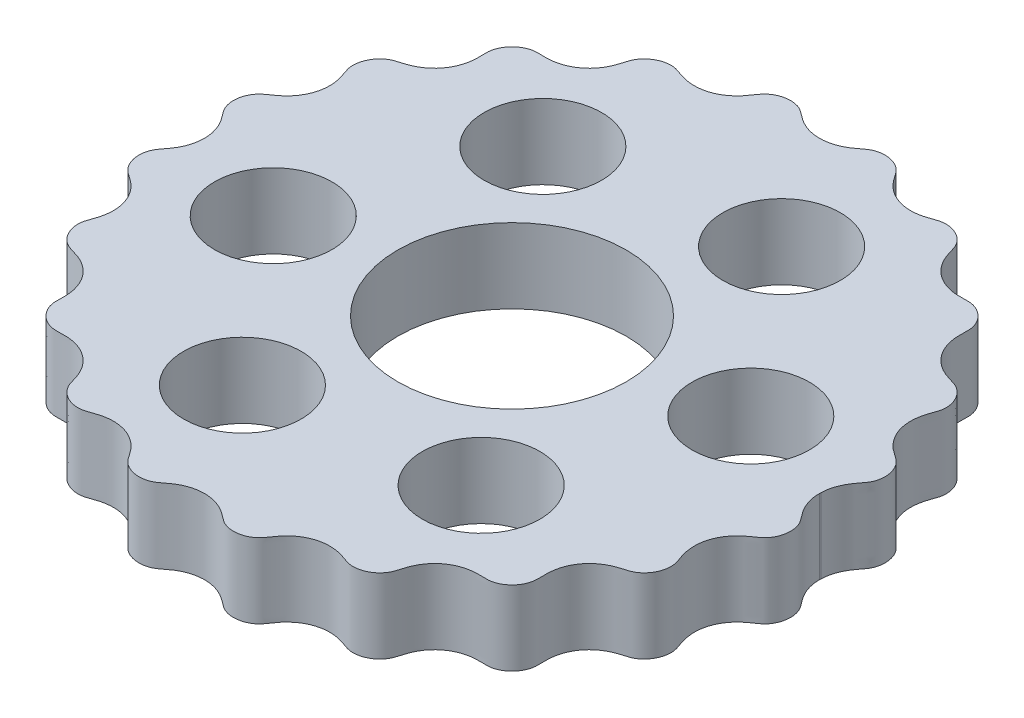
from build123d import *

# Parameters (mm, degrees)
SKETCH1_R           = 10.4
BOSS_EXTRUDE1_DEPTH = 6.8
SKETCH3_R           = 5.35
CUT_EXTRUDE1_DEPTH  = 43.495833342


with BuildPart() as part:
    # Sketch1 → Boss-Extrude1 (new body)
    with BuildSketch(Plane(origin=(0, 0, 0), x_dir=(1, 0, 0), z_dir=(0, 1, 0))):
        with BuildLine():
            add(Edge.make_bspline(
                [(28, 0), (28, -0.031031349), (28.000664585, -0.077562013), (28.002880061, -0.148625962), (28.008857323, -0.265030804), (28.01748439, -0.378165866), (28.035377174, -0.532449994), (28.06975465, -0.744031815), (28.124898528, -0.988402272), (28.208291328, -1.260754977), (28.310763489, -1.527479674), (28.432264517, -1.78553412), (28.586475915, -2.065550339), (28.781240437, -2.361249596), (29.013710566, -2.671510887), (29.282434665, -2.997909262), (29.511090265, -3.399330908), (29.650641795, -3.879617947), (29.685943401, -4.415209937), (29.595050036, -4.98366351), (29.393332982, -5.482667687), (29.108390624, -5.897533807), (28.762039685, -6.207243903), (28.403477037, -6.435442884), (28.026266021, -6.701844442), (27.64319557, -7.023691154), (27.180082711, -7.524317118), (26.718464045, -8.267029277), (26.411916475, -9.252490746), (26.412585588, -10.23832478), (26.591144298, -11.003215534), (26.788245534, -11.554847613), (26.926996187, -11.920540426), (27.04353273, -12.498351115), (26.949273296, -13.292291113), (26.579231695, -14.011203462), (25.979864827, -14.553993599), (25.426081192, -14.793657027), (25.031899301, -14.895827838), (24.598577298, -15.029618089), (24.134125138, -15.214708043), (23.655411415, -15.480342094), (23.184349595, -15.840952149), (22.673753465, -16.373943796), (22.203830759, -17.12510049), (21.950799886, -17.926805445), (21.888983864, -18.704964764), (21.907789185, -19.286886173), (21.924859771, -19.675174385), (21.871149911, -20.111154063), (21.705597474, -20.571085866), (21.337846804, -21.153739973), (20.84201349, -21.573706881), (20.342413095, -21.80966339), (19.85014486, -21.905332113), (19.542764705, -21.922070062), (19.184788107, -21.90195931), (18.729055825, -21.895280733), (18.227020872, -21.931313679), (17.541142399, -22.068791717), (16.71738225, -22.413536733), (15.891229619, -23.048350202), (15.32362548, -23.857086792), (15.029931219, -24.575501935), (14.870744642, -25.131672024), (14.765974038, -25.503517496), (14.578093522, -25.897334327), (14.278137655, -26.27956758), (13.863211568, -26.621949382), (13.333466392, -26.885228535), (12.798871593, -27.009248508), (12.290552673, -27.011301219), (11.843557682, -26.90219562), (11.460571198, -26.75121757), (11.025689397, -26.60543435), (10.534018496, -26.485849414), (9.834176397, -26.408732243), (8.943191753, -26.48928166), (8.101715728, -26.795494492), (7.375116763, -27.296483528), (6.902348496, -27.776858053), (6.606598531, -28.155474042), (6.366083646, -28.513256616), (6.151840123, -28.831695176), (5.850343501, -29.143571455), (5.44849282, -29.410335403), (4.952930608, -29.603689196), (4.378140564, -29.688000673), (3.887171763, -29.648261477), (3.499857409, -29.537846694), (3.21757098, -29.405101209), (3.027395345, -29.289163366), (2.803594257, -29.123996953), (2.543296711, -28.915671476), (2.200975392, -28.666191524), (1.757738569, -28.405972128), (1.252718637, -28.191044593), (0.688410871, -28.043749551), (-0.032568257, -27.968354591), (-0.75572454, -28.038417959), (-1.447945714, -28.250687916), (-2.040364953, -28.563265751), (-2.43508463, -28.83214679), (-2.771481416, -29.097279113), (-3.073006342, -29.330941262), (-3.455359553, -29.529806436), (-3.917651053, -29.656056137), (-4.447139358, -29.684551772), (-5.019569429, -29.585408027), (-5.526314972, -29.371633211), (-5.901089956, -29.099575061), (-6.149417714, -28.82430515), (-6.342916663, -28.55017367), (-6.52768605, -28.270341803), (-6.778653094, -27.926106571), (-7.123898857, -27.541297135), (-7.542497613, -27.181412054), (-8.038978416, -26.868913717), (-8.708238445, -26.578220526), (-9.424190957, -26.427468439), (-10.153540712, -26.423523025), (-10.812857393, -26.54571293), (-11.265134105, -26.682147995), (-11.657194526, -26.828411897), (-12.003570583, -26.949288237), (-12.419349208, -27.0163226), (-12.893155845, -26.993505697), (-13.405546162, -26.856727423), (-13.922436399, -26.582438076), (-14.297340969, -26.255785564), (-14.545228892, -25.932420691), (-14.693513799, -25.653848142), (-14.777193881, -25.44474727), (-14.859768339, -25.175886882), (-14.94961111, -24.850892912), (-15.084325599, -24.444125067), (-15.297380805, -23.969854579), (-15.589092151, -23.497394056), (-15.970296988, -23.047055376), (-16.413014657, -22.662440809), (-16.905975708, -22.351506466), (-17.436562915, -22.119690928), (-17.991822389, -21.968687816), (-18.510209424, -21.903570911), (-18.979622982, -21.895472642), (-19.395216231, -21.914147378), (-19.760122128, -21.919892844), (-20.173368062, -21.852207015), (-20.613313595, -21.682775401), (-21.055976613, -21.393420873), (-21.461345683, -20.97164431), (-21.715951351, -20.543138764), (-21.850483054, -20.156060997), (-21.903595175, -19.843149855), (-21.917067504, -19.61707751), (-21.911419002, -19.334325238), (-21.896813922, -18.995552281), (-21.900821651, -18.564628351), (-21.95998452, -18.045081696), (-22.095709809, -17.503380239), (-22.324562172, -16.955868497), (-22.631906223, -16.454539193), (-23.008454099, -16.009979236), (-23.443097224, -15.630575573), (-23.923502175, -15.320894907), (-24.394614793, -15.102998218), (-24.836373872, -14.95288347), (-25.235273193, -14.843563999), (-25.58163527, -14.734658302), (-25.950103295, -14.540740978), (-26.31233868, -14.243529727), (-26.641372876, -13.831416863), (-26.894800573, -13.304359235), (-27.002946452, -12.816593176), (-27.009112874, -12.404516787), (-26.960506386, -12.089055157), (-26.901637758, -11.86907346), (-26.807460002, -11.600758064), (-26.688704284, -11.281110833), (-26.560148648, -10.867230496), (-26.458033102, -10.351364226), (-26.423156439, -9.790825053), (-26.476420934, -9.196404965), (-26.619091955, -8.624310238), (-26.844481609, -8.087344303), (-27.143662697, -7.596479599), (-27.505502372, -7.159053145), (-27.885770863, -6.810752242), (-28.258231334, -6.534623838), (-28.602197984, -6.309201905), (-28.895071379, -6.097739956), (-29.181628557, -5.798860374), (-29.430622755, -5.405352873), (-29.613193841, -4.914013425), (-29.689431096, -4.338059144), (-29.641317845, -3.842066694), (-29.519046209, -3.447630328), (-29.347230354, -3.107551616), (-29.176911045, -2.87010865), (-28.994326163, -2.643518506), (-28.784933249, -2.363547245), (-28.571500211, -2.047545383), (-28.345161016, -1.633004027), (-28.14358345, -1.107376567), (-28.017029617, -0.525985365), (-27.981859645, 0.060151868), (-28.035406584, 0.637175938), (-28.172082425, 1.192026354), (-28.383290312, 1.714776498), (-28.63818744, 2.159125147), (-28.906808596, 2.533486567), (-29.163211752, 2.852024262), (-29.373361181, 3.143662764), (-29.54964244, 3.51572955), (-29.661770312, 3.964827844), (-29.681448424, 4.487079756), (-29.574218643, 5.057988123), (-29.372915323, 5.515007066), (-29.131683637, 5.853186557), (-28.901310345, 6.081455236), (-28.71733887, 6.22699728), (-28.523830586, 6.359217381), (-28.329480908, 6.489865049), (-28.090288895, 6.658903412), (-27.789146582, 6.896331732), (-27.445538533, 7.224109569), (-27.092401473, 7.666596028), (-26.794617181, 8.185486692), (-26.584211015, 8.735334535), (-26.461833383, 9.301427774), (-26.425227124, 9.869575923), (-26.468172124, 10.427796633), (-26.57539464, 10.925269878), (-26.715902845, 11.361033992), (-26.860864887, 11.740964632), (-26.967643183, 12.082349347), (-27.016923469, 12.488849335), (-26.982539247, 12.947562526), (-26.852213504, 13.40022156), (-26.632187174, 13.825541839), (-26.365823813, 14.173243793), (-26.076266903, 14.444258568), (-25.746657166, 14.660554827), (-25.384347071, 14.803955947), (-25.013174175, 14.901888221), (-24.649825417, 15.014330048), (-24.205456498, 15.183943807), (-23.697981694, 15.448136434), (-23.19279069, 15.821811464), (-22.727598822, 16.321001516), (-22.376687134, 16.856656853), (-22.130069092, 17.402971906), (-21.978147244, 17.949424395), (-21.913956294, 18.420845127), (-21.898301955, 18.804719145), (-21.901885571, 19.098138001), (-21.910364295, 19.332599431), (-21.917356186, 19.567290625), (-21.908247038, 19.802120465), (-21.859642973, 20.123388586), (-21.728314478, 20.518321223), (-21.477258115, 20.950469614), (-21.078915406, 21.373185728), (-20.645642238, 21.664528758), (-20.217606093, 21.838212475), (-19.81395087, 21.915200378), (-19.455090494, 21.91746772), (-19.047465403, 21.897158238), (-18.587695109, 21.899303041), (-18.079419392, 21.953162665), (-17.533342209, 22.087938967), (-17.004169367, 22.301728649), (-16.505109003, 22.596039084), (-16.050057404, 22.968007225), (-15.652263558, 23.411950504), (-15.343738112, 23.88416209), (-15.140451853, 24.311413051), (-15.00916899, 24.67024555), (-14.923108555, 24.949105909), (-14.859272465, 25.17353993), (-14.793147582, 25.397519172), (-14.710914793, 25.616330064), (-14.564233641, 25.904241858), (-14.316887562, 26.236050862), (-13.944188937, 26.567290224), (-13.433671312, 26.844662271), (-12.929592484, 26.986306774), (-12.465862868, 27.016938878), (-12.056290812, 26.961980817), (-11.713377661, 26.850314018), (-11.329649416, 26.704649039), (-10.888443566, 26.565360279), (-10.384483683, 26.461685167), (-9.819320952, 26.42479376), (-9.246932195, 26.46959031), (-8.679725254, 26.601148914), (-8.13189378, 26.820596294), (-7.61790981, 27.12615642), (-7.183298081, 27.483573339), (-6.824584378, 27.869492476), (-6.564372631, 28.217104645), (-6.3750587, 28.501500012), (-6.213296167, 28.736014133), (-6.07006888, 28.913600751), (-5.843517403, 29.139305653), (-5.5063042, 29.377601905), (-5.048020671, 29.577557287), (-4.472836828, 29.682943813), (-3.946505973, 29.659706968), (-3.493869262, 29.542417914), (-3.120634811, 29.359656954), (-2.828972318, 29.144471163), (-2.506836899, 28.886341612), (-2.126888917, 28.617266556), (-1.675206917, 28.363868325), (-1.144021603, 28.156435171), (-0.582661964, 28.02636271), (-0.001890933, 27.981296185), (0.58501359, 28.025647964), (1.163951978, 28.161086845), (1.683441687, 28.36893866), (2.139888531, 28.626125065), (2.491860332, 28.876215675), (2.757963051, 29.087427108), (2.983609202, 29.258786788), (3.174495471, 29.381446804), (3.459083205, 29.523339502), (3.851854319, 29.642968902), (4.348516024, 29.689533813), (4.928039846, 29.610137785), (5.422099408, 29.422934164), (5.817403714, 29.167853492), (6.115283499, 28.874692567), (6.325372059, 28.577061424), (6.553872205, 28.230405596), (6.835248426, 27.855825213), (7.191069249, 27.474840691), (7.637712718, 27.114121837), (8.135675959, 26.820050662), (8.676257821, 26.602398199), (9.247777769, 26.468503499), (9.8372148, 26.423188442), (10.392080485, 26.463744103), (10.902188743, 26.569430587), (11.311408894, 26.699284163), (11.627802053, 26.817712849), (11.894228581, 26.909467976), (12.112860236, 26.965303648), (12.42589622, 27.009896555), (12.834025678, 27.000146678), (13.319196858, 26.889378791), (13.845153306, 26.633026021), (14.257038724, 26.299760104), (14.554041609, 25.931167483), (14.744858665, 25.556647), (14.851157653, 25.206205972), (14.962768699, 24.803779515), (15.117305141, 24.3584135), (15.404121971, 23.753955429), (15.833875149, 23.165934197), (16.374909205, 22.67403309), (17.002579382, 22.301478605), (17.547717463, 22.081681443), (18.085705531, 21.953059447), (18.600843863, 21.899006114), (19.027718225, 21.897607026), (19.363306625, 21.912804166), (19.643510312, 21.916577445), (19.867343088, 21.900617162), (20.176671824, 21.844476785), (20.558874159, 21.70781217), (20.982160211, 21.452675575), (21.399217128, 21.048510346), (21.687723584, 20.604087838), (21.85771662, 20.157247476), (21.922648534, 19.732096865), (21.91156507, 19.351655854), (21.894463869, 18.92460385), (21.908205264, 18.448223307), (22.001912439, 17.786375903), (22.234946014, 17.101808505), (22.6013126, 16.474750796), (23.084711369, 15.934134159), (23.5354966, 15.562265361), (24.006530278, 15.278421196), (24.478137245, 15.071534791), (24.881821655, 14.940491454), (25.203951204, 14.852086447), (25.469756895, 14.768372409), (25.675938251, 14.683009626), (25.950151182, 14.533002939), (26.268223191, 14.284645826), (26.589714687, 13.910902088), (26.859890893, 13.396673658), (26.995311132, 12.88281003), (27.016525018, 12.402035718), (26.942836993, 11.975508372), (26.812034137, 11.615548358), (26.66389045, 11.211678455), (26.530995558, 10.751024764), (26.419030556, 10.087782053), (26.438423676, 9.205988209), (26.682840762, 8.344460734), (27.139678155, 7.574465368), (27.613264054, 7.051514451), (27.999218433, 6.72275474), (28.373217369, 6.455649292), (28.721151792, 6.234275947), (29.073689192, 5.937225968), (29.372166962, 5.524502035), (29.586978196, 5.018911749), (29.685919297, 4.435745593), (29.653681482, 3.899251815), (29.521743881, 3.432816911), (29.315424046, 3.049403046), (29.076634529, 2.746649138), (28.854976464, 2.462422135), (28.662547192, 2.185228529), (28.501739115, 1.916498604), (28.369735291, 1.659003295), (28.256193722, 1.392681001), (28.162088593, 1.119260422), (28.097627202, 0.874181121), (28.055500454, 0.660141377), (28.032146858, 0.504627846), (28.019647513, 0.390953761), (28.009738061, 0.273140835), (28.00514711, 0.200761759), (28.002956293, 0.153593073), (28.001951271, 0.122143989)],
                knots=[0.064575154, 0.064575154, 0.064575154, 0.064575154, 0.064575154, 0.065183591, 0.06548781, 0.065792028, 0.066400465, 0.067008902, 0.068225777, 0.069442651, 0.070659525, 0.0718764, 0.073093274, 0.074310148, 0.076111476, 0.077912804, 0.079714132, 0.08151546, 0.083941756, 0.086368053, 0.088809002, 0.091249952, 0.093061606, 0.09487326, 0.096684914, 0.098496568, 0.100945225, 0.103393881, 0.108291195, 0.113292604, 0.118294014, 0.119961376, 0.121628737, 0.123296099, 0.124963461, 0.129954037, 0.134964041, 0.136701765, 0.138439489, 0.140177212, 0.141914936, 0.144438131, 0.146961326, 0.149484521, 0.152007716, 0.156981085, 0.161954454, 0.163610909, 0.165267364, 0.166923819, 0.168580274, 0.171060329, 0.173540383, 0.178580711, 0.179454318, 0.180327926, 0.18207514, 0.183822355, 0.185569569, 0.18810821, 0.190646851, 0.195724132, 0.200669307, 0.205614481, 0.207260162, 0.208905843, 0.210551525, 0.212197206, 0.214661967, 0.217126729, 0.219661961, 0.222197193, 0.223953977, 0.225710761, 0.227467545, 0.229224329, 0.231778343, 0.234332357, 0.239440385, 0.244357202, 0.246815611, 0.24927402, 0.250909074, 0.252544127, 0.254179181, 0.255814235, 0.258263652, 0.26071307, 0.263180523, 0.265647975, 0.266596818, 0.26754566, 0.268494503, 0.269443345, 0.27134103, 0.273238715, 0.2757181, 0.278197486, 0.280676871, 0.283156257, 0.288044546, 0.29048869, 0.292932834, 0.294557358, 0.296181881, 0.297806404, 0.299430928, 0.301865085, 0.304299242, 0.306781128, 0.309263013, 0.311171465, 0.312125691, 0.313079917, 0.314988369, 0.316896821, 0.319390582, 0.321884343, 0.324378105, 0.326871866, 0.331797418, 0.334260193, 0.336722969, 0.338285219, 0.33984747, 0.34140972, 0.34297197, 0.345428594, 0.347885218, 0.350381431, 0.352877644, 0.353837262, 0.35479688, 0.355756498, 0.356716116, 0.358635353, 0.360554589, 0.363062682, 0.365570774, 0.368078866, 0.370586959, 0.373033529, 0.3754801, 0.377926671, 0.380373241, 0.381927053, 0.383480864, 0.385034676, 0.386588487, 0.389029846, 0.391471206, 0.393981633, 0.39649206, 0.397457075, 0.39842209, 0.399387105, 0.40035212, 0.402282151, 0.404212181, 0.406734559, 0.409256937, 0.411779314, 0.414301692, 0.41673198, 0.419162268, 0.421592556, 0.424022844, 0.425568398, 0.427113953, 0.428659507, 0.430205061, 0.432631132, 0.435057203, 0.437581726, 0.440106249, 0.441076661, 0.442047073, 0.443017486, 0.443987898, 0.445928723, 0.447869547, 0.450406163, 0.452942779, 0.455479396, 0.458016012, 0.460429941, 0.462843871, 0.465257801, 0.467671731, 0.469209216, 0.4707467, 0.472284185, 0.47382167, 0.476232438, 0.478643206, 0.481151977, 0.483660747, 0.484655025, 0.485649303, 0.487637859, 0.488632137, 0.489626415, 0.491614971, 0.494143736, 0.496672502, 0.499201267, 0.501730032, 0.50412753, 0.506525028, 0.508922526, 0.511320024, 0.512849634, 0.514379244, 0.515908855, 0.517438465, 0.519833922, 0.52222938, 0.524752243, 0.527275106, 0.528274831, 0.529274556, 0.530274281, 0.531274006, 0.532273731, 0.533273456, 0.535272906, 0.537815564, 0.540358222, 0.54290088, 0.545443538, 0.547824532, 0.550205527, 0.552586522, 0.554967517, 0.556489453, 0.558011389, 0.559533325, 0.561055261, 0.56343541, 0.565815558, 0.567501957, 0.569188355, 0.570874754, 0.572561152, 0.5741835, 0.575805847, 0.577428195, 0.579050543, 0.582295238, 0.585539933, 0.58808731, 0.590634686, 0.593182062, 0.595729438, 0.59773259, 0.598734166, 0.599735743, 0.600737319, 0.601738895, 0.602740471, 0.603742047, 0.606269677, 0.608797307, 0.611187553, 0.613577799, 0.615104774, 0.616631749, 0.618158724, 0.619685699, 0.622077587, 0.624469475, 0.626861363, 0.629253251, 0.631786751, 0.63432025, 0.63685375, 0.639387249, 0.641379516, 0.64237565, 0.643371783, 0.644367917, 0.64536405, 0.646360184, 0.647356317, 0.6498699, 0.652383483, 0.654789039, 0.657194596, 0.658729378, 0.66026416, 0.661798942, 0.663333725, 0.665742069, 0.668150414, 0.670558758, 0.672967102, 0.675508554, 0.678050006, 0.680591458, 0.68313291, 0.685077407, 0.687021905, 0.687994154, 0.688966403, 0.689938651, 0.6909109, 0.693440193, 0.695969486, 0.698390349, 0.700811213, 0.702353998, 0.703896784, 0.70543957, 0.706982356, 0.709407084, 0.711831812, 0.71425654, 0.716681268, 0.719208498, 0.721735728, 0.724262958, 0.726790188, 0.728723893, 0.730657598, 0.731624451, 0.732591303, 0.733558156, 0.734525008, 0.737040247, 0.739555486, 0.741991643, 0.744427801, 0.745978781, 0.747529761, 0.749080741, 0.75063172, 0.753072757, 0.755513794, 0.75795483, 0.760395867, 0.762908827, 0.765421788, 0.767934748, 0.770447708, 0.772370618, 0.774293529, 0.775254984, 0.776216439, 0.777177894, 0.778139349, 0.780640413, 0.783141477, 0.785592908, 0.78804434, 0.789603697, 0.791163055, 0.792722413, 0.79428177, 0.796739039, 0.799196307, 0.804110844, 0.806609488, 0.809108133, 0.811606778, 0.814105422, 0.816017544, 0.817929665, 0.818885726, 0.819841786, 0.820797847, 0.821753908, 0.824240683, 0.826727458, 0.829156674, 0.831585891, 0.833206737, 0.834827583, 0.83644843, 0.838069276, 0.840508545, 0.842947813, 0.84782635, 0.850310634, 0.852794918, 0.855279202, 0.857763486, 0.859664834, 0.861566181, 0.862516855, 0.863467529, 0.864418203, 0.865368876, 0.867841254, 0.870313631, 0.872757815, 0.875201999, 0.876833471, 0.878464943, 0.880096415, 0.881727888, 0.88418145, 0.886635013, 0.891542139, 0.8966606, 0.89921983, 0.901779061, 0.903539119, 0.905299177, 0.907059235, 0.908819293, 0.911359631, 0.91389997, 0.916359513, 0.918819057, 0.920461103, 0.92210315, 0.923745196, 0.925387243, 0.926621128, 0.927855013, 0.929088898, 0.930322783, 0.931556668, 0.932790553, 0.933407496, 0.934024438, 0.93433291, 0.934641381, 0.935258323, 0.935258323, 0.935258323, 0.935258323, 0.935258323], degree=4))
            Line((28.001951271, 0.122143989), (28, 0))
        make_face()
        Circle(SKETCH1_R, mode=Mode.SUBTRACT)
    extrude(amount=BOSS_EXTRUDE1_DEPTH)

    # Sketch3 → Cut-Extrude1 (cut, through all)
    with BuildSketch(Plane(origin=(0, 6.8, 0), x_dir=(1, 0, 0), z_dir=(0, 1, 0))):
        with Locations((-18.766078471, -2.972254836)):
            Circle(SKETCH3_R)
        with Locations((-11.95708743, 14.765773268)):
            Circle(SKETCH3_R)
        with Locations((6.808991041, 17.738028103)):
            Circle(SKETCH3_R)
        with Locations((18.766078471, 2.972254836)):
            Circle(SKETCH3_R)
        with Locations((11.95708743, -14.765773268)):
            Circle(SKETCH3_R)
        with Locations((-6.808991041, -17.738028103)):
            Circle(SKETCH3_R)
    extrude(amount=-CUT_EXTRUDE1_DEPTH, mode=Mode.SUBTRACT)


solid = part.part
